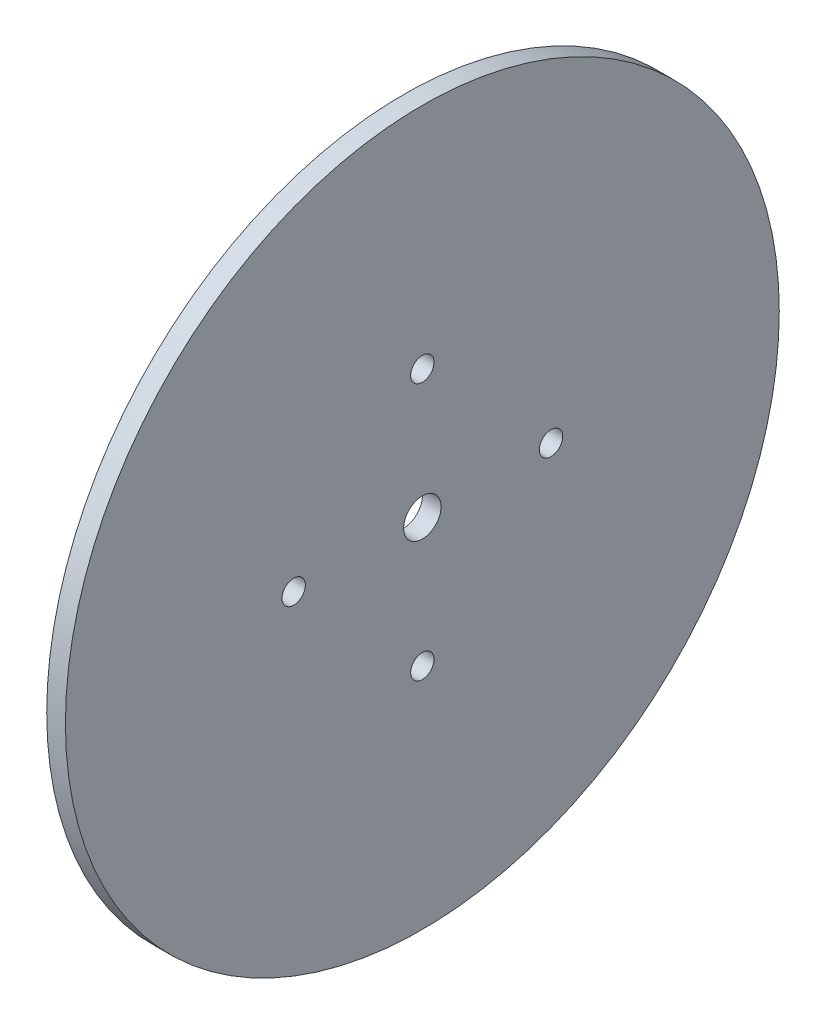
from build123d import *

# Parameters (mm, degrees)
SKETCH1_R           = 76.29
SKETCH1_R_2         = 2.5
SKETCH1_R_3         = 4
BOSS_EXTRUDE1_DEPTH = 4


with BuildPart() as part:
    # Sketch1 → Boss-Extrude1 (new body)
    with BuildSketch(Plane(origin=(0, 0, 0), x_dir=(0, 0, -1), z_dir=(1, 0, 0))):
        Circle(SKETCH1_R)
        with Locations((0, 27.5)):
            Circle(SKETCH1_R_2, mode=Mode.SUBTRACT)
        with Locations((27.5, 0)):
            Circle(SKETCH1_R_2, mode=Mode.SUBTRACT)
        with Locations((0, -27.5)):
            Circle(SKETCH1_R_2, mode=Mode.SUBTRACT)
        with Locations((-27.5, 0)):
            Circle(SKETCH1_R_2, mode=Mode.SUBTRACT)
        Circle(SKETCH1_R_3, mode=Mode.SUBTRACT)
    extrude(amount=BOSS_EXTRUDE1_DEPTH)


solid = part.part
